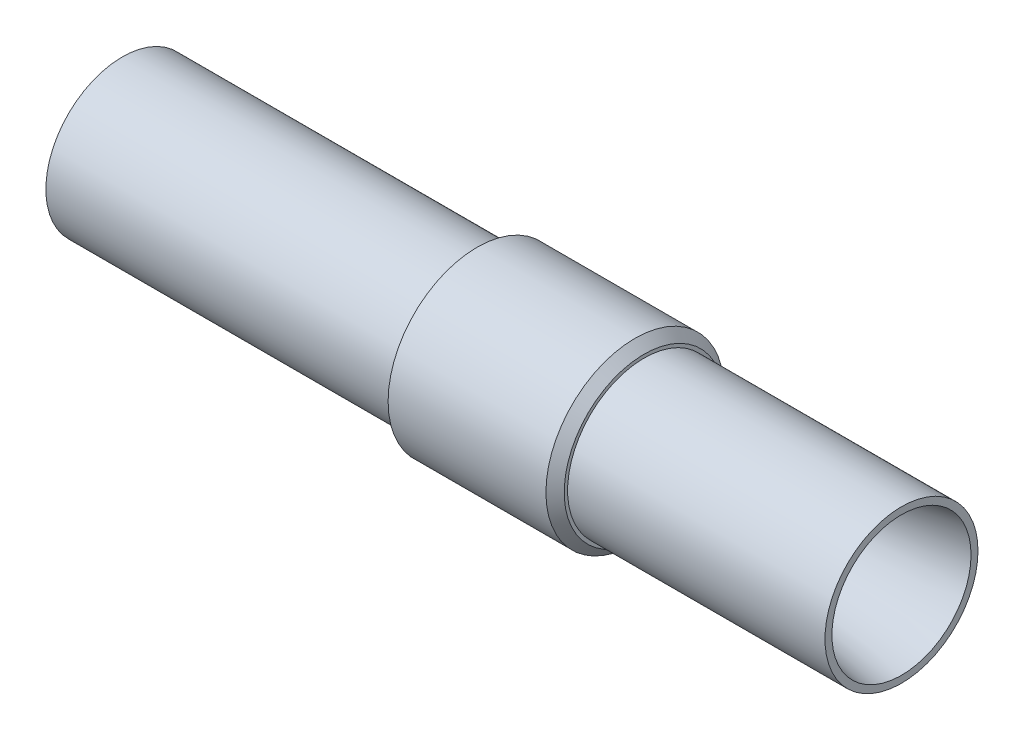
from build123d import *

# Parameters (mm, degrees)
SKETCH_2_R      = 32
SKETCH_2_R_2    = 27.5
EXTRUDE_1_DEPTH = 60
CHAMFER_1_SIZE  = 3.2875


with BuildPart() as part:
    # Эскиз1 → Повернуть1 (revolve)
    with BuildSketch(Plane.XY, mode=Mode.PRIVATE) as revolve_1_sk:
        Polygon((0, 27.5), (-280, 27.5), (-280, 25), (-145, 12.5), (-77.5, 12.5), (0, 25), align=None)
    revolve(revolve_1_sk.sketch.rotate(Axis((0, 0, 0), (-1, 0, 0)), 90), axis=Axis((0, 0, 0), (-1, 0, 0)))

    # Эскиз2 → Бобышка-Вытянуть1 (add)
    with BuildSketch(Plane(origin=(-152.5, 0, 0), x_dir=(0, 0, -1), z_dir=(1, 0, 0))):
        Circle(SKETCH_2_R)
        Circle(SKETCH_2_R_2, mode=Mode.SUBTRACT)
    extrude(amount=EXTRUDE_1_DEPTH)

    # Фаска1
    chamfer_1_edges = [part.edges().sort_by_distance(p)[0] for p in [
        (-92.5, 0, 32),
    ]]
    chamfer(chamfer_1_edges, length=CHAMFER_1_SIZE)


solid = part.part
